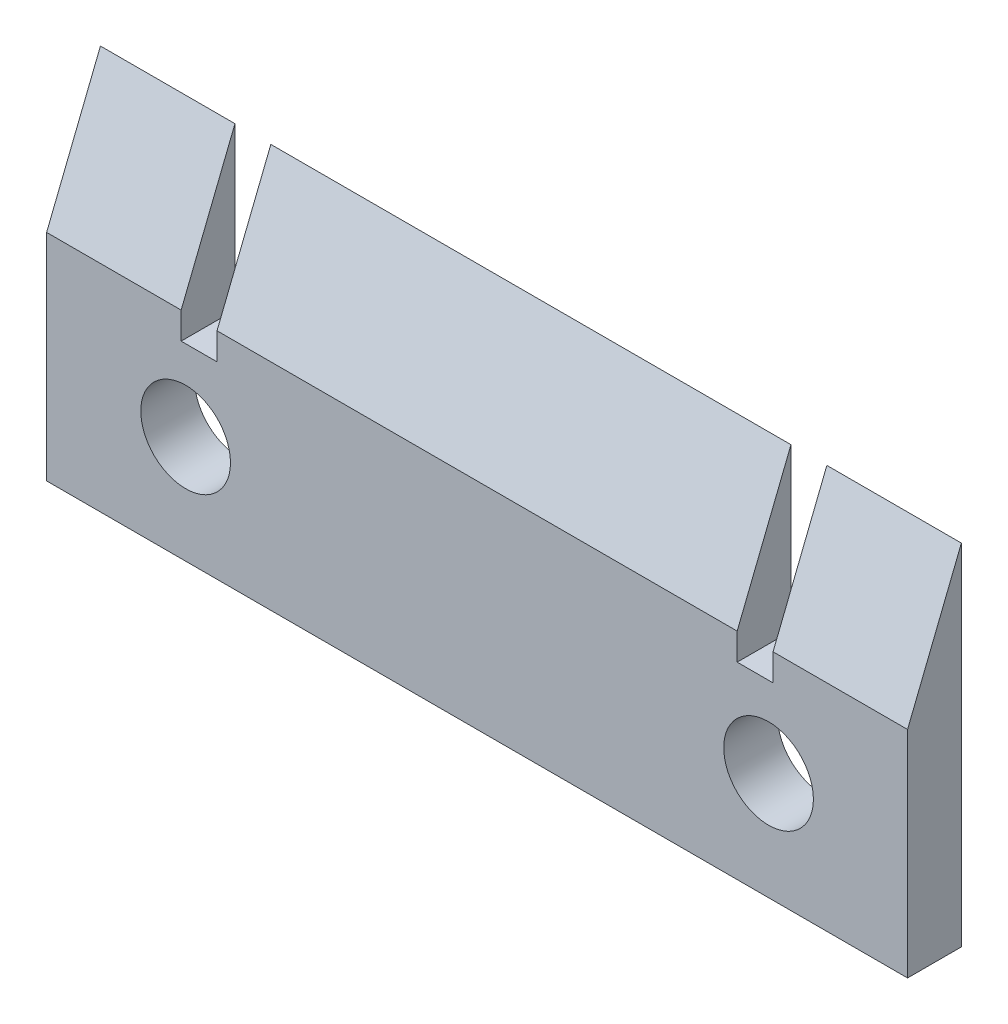
from build123d import *

# Parameters (mm, degrees)
SKETCH_1_W               = 96
SKETCH_1_H               = 39
EXTRUDE_1_DEPTH          = 6
CUT_EXTRUDE_1_DEPTH      = 104.793063352
CUT_EXTRUDE_1_DEPTH_BACK = 104.793063352
SKETCH_3_W               = 4
SKETCH_3_H               = 18
CUT_EXTRUDE_1_2_DEPTH    = 63.136945532
SKETCH_4_R               = 5
CUT_EXTRUDE_2_DEPTH      = 63.136945532


with BuildPart() as part:
    # 草图1 → 凸台-拉伸1 (new body)
    with BuildSketch(Plane.XY):
        with Locations((0, 19.5)):
            Rectangle(SKETCH_1_W, SKETCH_1_H)
    extrude(amount=EXTRUDE_1_DEPTH)

    # 草图2 → Cut-Extrude 1 (cut, two sides: drawn at the far end of the back side and taken through both)
    with BuildSketch(Plane(origin=(48, 0, 0), x_dir=(0, 0, -1), z_dir=(1, 0, 0)).offset(-CUT_EXTRUDE_1_DEPTH_BACK)):
        Polygon((-39.023196805, -58.557992014), (-6, 24), (0, 39), (33.023196805, 121.557992014), (-132.092787222, 187.604385624), (-204.139180832, 7.488401597), align=None)
    extrude(amount=CUT_EXTRUDE_1_DEPTH + CUT_EXTRUDE_1_DEPTH_BACK, mode=Mode.SUBTRACT)

    # 草图3 → Cut-Extrude 1 2 (cut, symmetric)
    with BuildSketch(Plane.XY.offset(6)):
        with Locations((-31, 30)):
            Rectangle(SKETCH_3_W, SKETCH_3_H)
    cut_extrude_1_2 = extrude(amount=CUT_EXTRUDE_1_2_DEPTH, both=True, mode=Mode.SUBTRACT)

    # 镜向1: Cut-Extrude 1 2 across plane
    add(cut_extrude_1_2.mirror(Plane(origin=(0, 0, 0), x_dir=(0, 0, 1), z_dir=(1, 0, 0))), mode=Mode.SUBTRACT)

    # 草图4 → 切除-拉伸2 (cut, through all)
    with BuildSketch(Plane.XY.offset(6)):
        with Locations((32.5, 12)):
            Circle(SKETCH_4_R)
        with Locations((-32.5, 12)):
            Circle(SKETCH_4_R)
    extrude(amount=-CUT_EXTRUDE_2_DEPTH, mode=Mode.SUBTRACT)


solid = part.part
